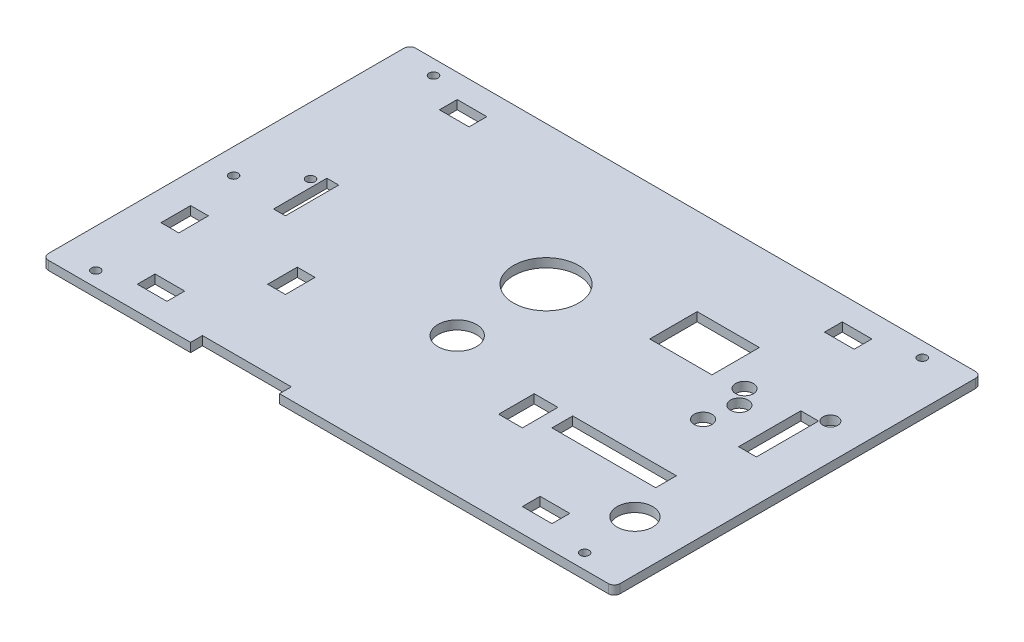
from build123d import *

# Parameters (mm, degrees)
SKETCH1_W           = 193
SKETCH1_H           = 124
SKETCH1_R           = 1.5
BOSS_EXTRUDE1_DEPTH = 3
SKETCH2_R           = 3
SKETCH2_R_2         = 2.5
SKETCH2_R_3         = 6
SKETCH2_W           = 35
SKETCH2_H           = 7
SKETCH2_W_2         = 21
SKETCH2_H_2         = 16
SKETCH2_W_3         = 6
SKETCH2_H_3         = 21
SKETCH2_W_4         = 8
SKETCH2_H_4         = 12
CUT_EXTRUDE1_DEPTH  = 230.421010372
SKETCH3_R           = 11
SKETCH3_R_2         = 6.5
CUT_EXTRUDE2_DEPTH  = 230.421010372
SKETCH4_W           = 10
SKETCH4_H           = 6
CUT_EXTRUDE3_DEPTH  = 230.421010372
SKETCH5_W           = 30
SKETCH5_H           = 4
CUT_EXTRUDE4_DEPTH  = 230.421010372
SKETCH6_R           = 1.5
SKETCH6_W           = 4
SKETCH6_H           = 18
CUT_EXTRUDE5_DEPTH  = 230.421010372
SKETCH7_W           = 6
SKETCH7_H           = 10
CUT_EXTRUDE6_DEPTH  = 230.421010372
FILLET1_R           = 2


with BuildPart() as part:
    # Sketch1 → Boss-Extrude1 (new body)
    with BuildSketch(Plane(origin=(0, 0, 0), x_dir=(1, 0, 0), z_dir=(0, 1, 0))):
        with Locations((96.5, 62)):
            Rectangle(SKETCH1_W, SKETCH1_H)
        with Locations(Location((13, 119, 0), (0, 0, 270))):
            Circle(SKETCH1_R, mode=Mode.SUBTRACT)
        with Locations(Location((178, 119, 0), (0, 0, 270))):
            Circle(SKETCH1_R, mode=Mode.SUBTRACT)
        with Locations(Location((13, 5, 0), (0, 0, 270))):
            Circle(SKETCH1_R, mode=Mode.SUBTRACT)
        with Locations(Location((178, 5, 0), (0, 0, 270))):
            Circle(SKETCH1_R, mode=Mode.SUBTRACT)
    extrude(amount=BOSS_EXTRUDE1_DEPTH)

    # Sketch2 → Cut-Extrude1 (cut, through all)
    with BuildSketch(Plane(origin=(0, 3, 0), x_dir=(1, 0, 0), z_dir=(0, 1, 0))):
        with Locations(Location((157, 80, 0), (0, 0, 270))):
            Circle(SKETCH2_R)
        with Locations(Location((161, 74.255437353, 0), (0, 0, 270))):
            Circle(SKETCH2_R)
        with Locations(Location((159, 64, 0), (0, 0, 270))):
            Circle(SKETCH2_R)
        with Locations(Location((181, 85, 0), (0, 0, 270))):
            Circle(SKETCH2_R_2)
        with Locations(Location((176, 24, 0), (0, 0, 270))):
            Circle(SKETCH2_R_3)
        with Locations((153.5, 39.5)):
            Rectangle(SKETCH2_W, SKETCH2_H)
        with Locations((137, 86.5)):
            Rectangle(SKETCH2_W_2, SKETCH2_H_2)
        with Locations((176, 72.5)):
            Rectangle(SKETCH2_W_3, SKETCH2_H_3)
        with Locations((127, 37)):
            Rectangle(SKETCH2_W_4, SKETCH2_H_4)
    extrude(amount=-CUT_EXTRUDE1_DEPTH, mode=Mode.SUBTRACT)

    # Sketch3 → Cut-Extrude2 (cut, through all)
    with BuildSketch(Plane(origin=(0, 3, 0), x_dir=(1, 0, 0), z_dir=(0, 1, 0))):
        with Locations(Location((93, 77, 0), (0, 0, 270))):
            Circle(SKETCH3_R)
        with Locations(Location((93, 47, 0), (0, 0, 270))):
            Circle(SKETCH3_R_2)
    extrude(amount=-CUT_EXTRUDE2_DEPTH, mode=Mode.SUBTRACT)

    # Sketch4 → Cut-Extrude3 (cut, through all)
    with BuildSketch(Plane(origin=(0, 3, 0), x_dir=(1, 0, 0), z_dir=(0, 1, 0))):
        with Locations((29, 113)):
            Rectangle(SKETCH4_W, SKETCH4_H)
        with Locations((159, 113)):
            Rectangle(SKETCH4_W, SKETCH4_H)
        with Locations((29, 11)):
            Rectangle(SKETCH4_W, SKETCH4_H)
        with Locations((159, 11)):
            Rectangle(SKETCH4_W, SKETCH4_H)
    extrude(amount=-CUT_EXTRUDE3_DEPTH, mode=Mode.SUBTRACT)

    # Sketch5 → Cut-Extrude4 (cut, through all)
    with BuildSketch(Plane(origin=(0, 3, 0), x_dir=(1, 0, 0), z_dir=(0, 1, 0))):
        with Locations((65, 2)):
            Rectangle(SKETCH5_W, SKETCH5_H)
    extrude(amount=-CUT_EXTRUDE4_DEPTH, mode=Mode.SUBTRACT)

    # Sketch6 → Cut-Extrude5 (cut, through all)
    with BuildSketch(Plane(origin=(0, 3, 0), x_dir=(1, 0, 0), z_dir=(0, 1, 0))):
        with Locations(Location((8.5, 56, 0), (0, 0, 270))):
            Circle(SKETCH6_R)
        with Locations(Location((22.5, 68, 0), (0, 0, 270))):
            Circle(SKETCH6_R)
        with Locations((27, 62)):
            Rectangle(SKETCH6_W, SKETCH6_H)
    extrude(amount=-CUT_EXTRUDE5_DEPTH, mode=Mode.SUBTRACT)

    # Sketch7 → Cut-Extrude6 (cut, through all)
    with BuildSketch(Plane(origin=(0, 3, 0), x_dir=(1, 0, 0), z_dir=(0, 1, 0))):
        with Locations((13, 35)):
            Rectangle(SKETCH7_W, SKETCH7_H)
        with Locations((49, 35)):
            Rectangle(SKETCH7_W, SKETCH7_H)
    extrude(amount=-CUT_EXTRUDE6_DEPTH, mode=Mode.SUBTRACT)

    # Fillet1
    fillet1_edges = [part.edges().sort_by_distance(p)[0] for p in [
        (0, 1.5, -124),
        (193, 1.5, -124),
        (193, 1.5, 0),
        (0, 1.5, 0),
    ]]
    fillet(fillet1_edges, radius=FILLET1_R)


solid = part.part
